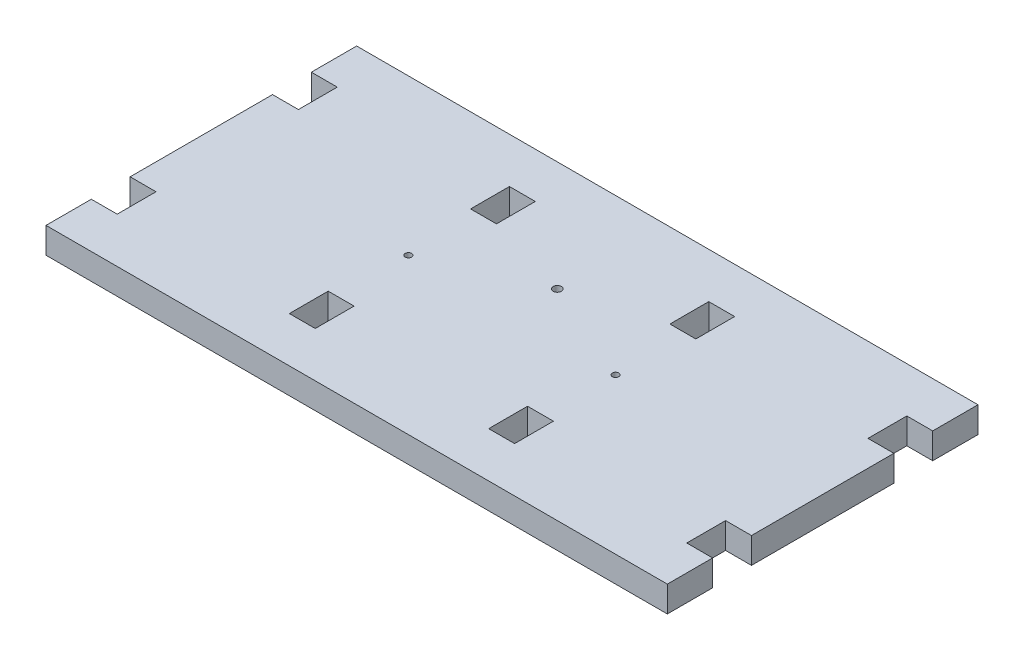
from build123d import *

# Parameters (mm, degrees)
SKETCH1_W          = 304.8
SKETCH1_H          = 152.4
EXTRUDE1_DEPTH     = 12.7
SKETCH2_W          = 12.7
SKETCH2_H          = 19.05
EXTRUDE2_DEPTH     = 171.861025398
SKETCH3_R          = 1.5875
CUT_EXTRUDE1_DEPTH = 171.861025398
SKETCH4_R          = 2.032
CUT_EXTRUDE2_DEPTH = 171.861025398


with BuildPart() as part:
    # Sketch1 → Extrude1 (new body)
    with BuildSketch(Plane(origin=(0, 0, 0), x_dir=(1, 0, 0), z_dir=(0, 1, 0))):
        Rectangle(SKETCH1_W, SKETCH1_H)
    extrude(amount=EXTRUDE1_DEPTH)

    # Sketch2 → Extrude2 (cut, through all)
    with BuildSketch(Plane(origin=(0, 12.7, 0), x_dir=(1, 0, 0), z_dir=(0, 1, 0))):
        with Locations((-48.895, 44.45)):
            Rectangle(SKETCH2_W, SKETCH2_H)
        with Locations((48.895, 44.45)):
            Rectangle(SKETCH2_W, SKETCH2_H)
        with Locations((-48.895, -44.45)):
            Rectangle(SKETCH2_W, SKETCH2_H)
        with Locations((48.895, -44.45)):
            Rectangle(SKETCH2_W, SKETCH2_H)
        with Locations((146.05, 44.45)):
            Rectangle(SKETCH2_W, SKETCH2_H)
        with Locations((-146.05, 44.45)):
            Rectangle(SKETCH2_W, SKETCH2_H)
        with Locations((146.05, -44.45)):
            Rectangle(SKETCH2_W, SKETCH2_H)
        with Locations((-146.05, -44.45)):
            Rectangle(SKETCH2_W, SKETCH2_H)
    extrude(amount=-EXTRUDE2_DEPTH, mode=Mode.SUBTRACT)

    # Sketch3 → Cut-Extrude1 (cut, through all)
    with BuildSketch(Plane.XZ):
        with Locations(Location((50.8, 0, 0), (0, 0, 270))):
            Circle(SKETCH3_R)
        with Locations(Location((-50.8, 0, 0), (0, 0, 270))):
            Circle(SKETCH3_R)
    extrude(amount=-CUT_EXTRUDE1_DEPTH, mode=Mode.SUBTRACT)

    # Sketch4 → Cut-Extrude2 (cut, through all)
    with BuildSketch(Plane(origin=(0, 12.7, 0), x_dir=(1, 0, 0), z_dir=(0, 1, 0))):
        with Locations(Location((0, 22.225, 0), (0, 0, 270))):
            Circle(SKETCH4_R)
    extrude(amount=-CUT_EXTRUDE2_DEPTH, mode=Mode.SUBTRACT)


solid = part.part
